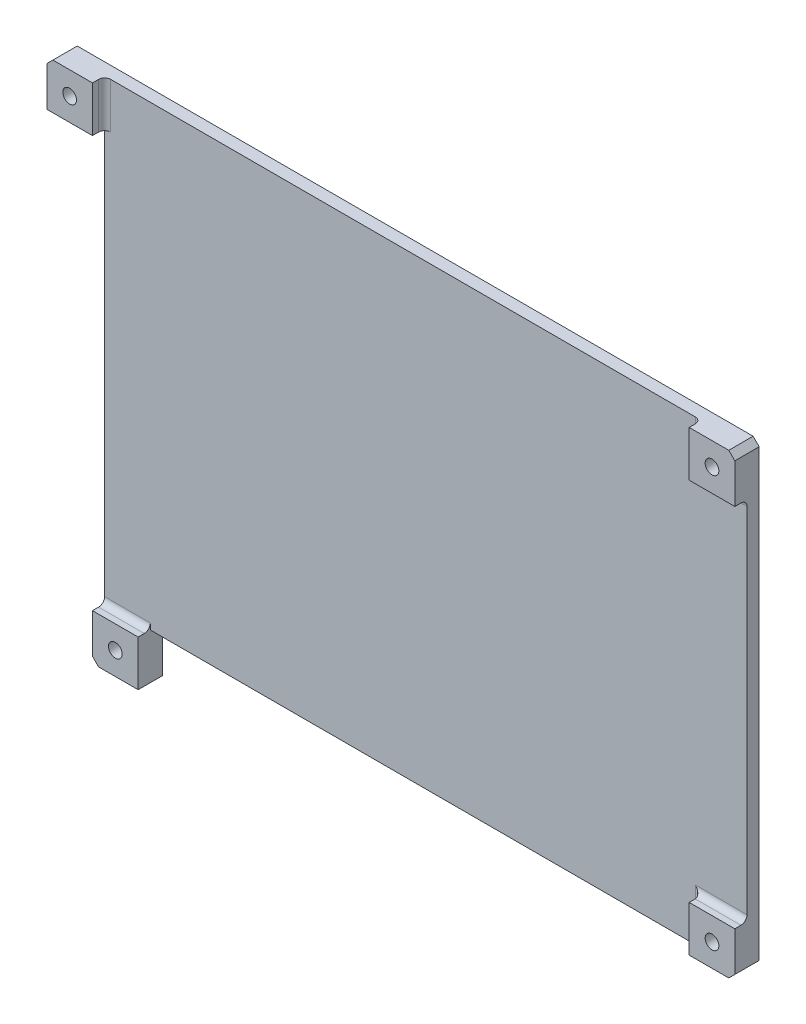
from build123d import *

# Parameters (mm, degrees)
SKETCH1_W           = 105.5
SKETCH1_H           = 75.06
BOSS_EXTRUDE1_DEPTH = 2
SKETCH2_W           = 7.5
SKETCH2_H           = 7.5
SKETCH2_R           = 1.125
BOSS_EXTRUDE2_DEPTH = 2
CUT_EXTRUDE1_START  = -4
SKETCH3_R           = 1.125
CUT_EXTRUDE1_DEPTH  = 4
SKETCH4_R           = 1.125
CUT_EXTRUDE2_DEPTH  = 4
SKETCH5_W           = 7.5
SKETCH5_H           = 7.5
BOSS_EXTRUDE3_DEPTH = 2
SKETCH6_R           = 1.125
CUT_EXTRUDE3_DEPTH  = 4
SKETCH7_W           = 7.5
SKETCH7_H           = 7.5
BOSS_EXTRUDE4_DEPTH = 2
SKETCH8_R           = 1.125
CUT_EXTRUDE4_DEPTH  = 4
FILLET2_R           = 1
FILLET3_R           = 1
CHAMFER1_SIZE       = 1


with BuildPart() as part:
    # Sketch1 → Boss-Extrude1 (new body)
    with BuildSketch(Plane.XY):
        with Locations((9.308823529, -13.027464503)):
            Rectangle(SKETCH1_W, SKETCH1_H)
    extrude(amount=BOSS_EXTRUDE1_DEPTH)

    # Sketch2 → Boss-Extrude2 (add)
    # profile 1 of 2: a face of its own
    with BuildSketch(Plane.XY.offset(2)):
        with Locations((58.308823529, -46.807464503)):
            Rectangle(SKETCH2_W, SKETCH2_H)
    # profile 2 of 2: a face of its own
    with BuildSketch(Plane.XY.offset(2)):
        with Locations((58.308823529, 20.752535497)):
            Rectangle(SKETCH2_W, SKETCH2_H)
        with Locations((58.308823529, 20.752535497)):
            Circle(SKETCH2_R, mode=Mode.SUBTRACT)
    extrude(amount=BOSS_EXTRUDE2_DEPTH)

    # Sketch3 → Cut-Extrude1 (cut)
    with BuildSketch(Plane.XY.offset(2).offset(CUT_EXTRUDE1_START)):
        with Locations((58.308823529, 20.752535497)):
            Circle(SKETCH3_R)
    extrude(amount=CUT_EXTRUDE1_DEPTH, mode=Mode.SUBTRACT)

    # Sketch4 → Cut-Extrude2 (cut)
    with BuildSketch(Plane.XY.offset(4)):
        with Locations((58.308823529, -46.807464503)):
            Circle(SKETCH4_R)
    extrude(amount=-CUT_EXTRUDE2_DEPTH, mode=Mode.SUBTRACT)

    # Sketch5 → Boss-Extrude3 (add, symmetric)
    with BuildSketch(Plane.XY.offset(2)):
        with Locations((-47.191176471, 20.752535497)):
            Rectangle(SKETCH5_W, SKETCH5_H)
    extrude(amount=BOSS_EXTRUDE3_DEPTH, both=True)

    # Sketch6 → Cut-Extrude3 (cut)
    with BuildSketch(Plane.XY.offset(4)):
        with Locations((-47.191176471, 20.752535497)):
            Circle(SKETCH6_R)
    extrude(amount=-CUT_EXTRUDE3_DEPTH, mode=Mode.SUBTRACT)

    # Sketch7 → Boss-Extrude4 (add, symmetric)
    with BuildSketch(Plane.XY.offset(2)):
        with Locations((-39.691176471, -54.307464503)):
            Rectangle(SKETCH7_W, SKETCH7_H)
    extrude(amount=BOSS_EXTRUDE4_DEPTH, both=True)

    # Sketch8 → Cut-Extrude4 (cut)
    with BuildSketch(Plane.XY.offset(4)):
        with Locations((-39.691176471, -54.307464503)):
            Circle(SKETCH8_R)
    extrude(amount=-CUT_EXTRUDE4_DEPTH, mode=Mode.SUBTRACT)

    # Fillet2
    fillet2_edges = [part.edges().sort_by_distance(p)[0] for p in [
        (-39.691176471, -50.557464503, 2),
        (-43.441176471, 20.752535497, 2),
    ]]
    fillet(fillet2_edges, radius=FILLET2_R)

    # Fillet3
    fillet3_edges = [part.edges().sort_by_distance(p)[0] for p in [
        (54.558823529, 20.752535497, 2),
        (58.308823529, 17.002535497, 2),
        (54.558823529, -46.807464503, 2),
        (58.308823529, -43.057464503, 2),
    ]]
    fillet(fillet3_edges, radius=FILLET3_R)

    # Chamfer1
    chamfer1_edges = [part.edges().sort_by_distance(p)[0] for p in [
        (-50.941176471, 24.502535497, 2),
        (-43.441176471, -58.057464503, 2),
        (62.058823529, 24.502535497, 2),
        (62.058823529, -50.557464503, 2),
    ]]
    chamfer(chamfer1_edges, length=CHAMFER1_SIZE)


solid = part.part
